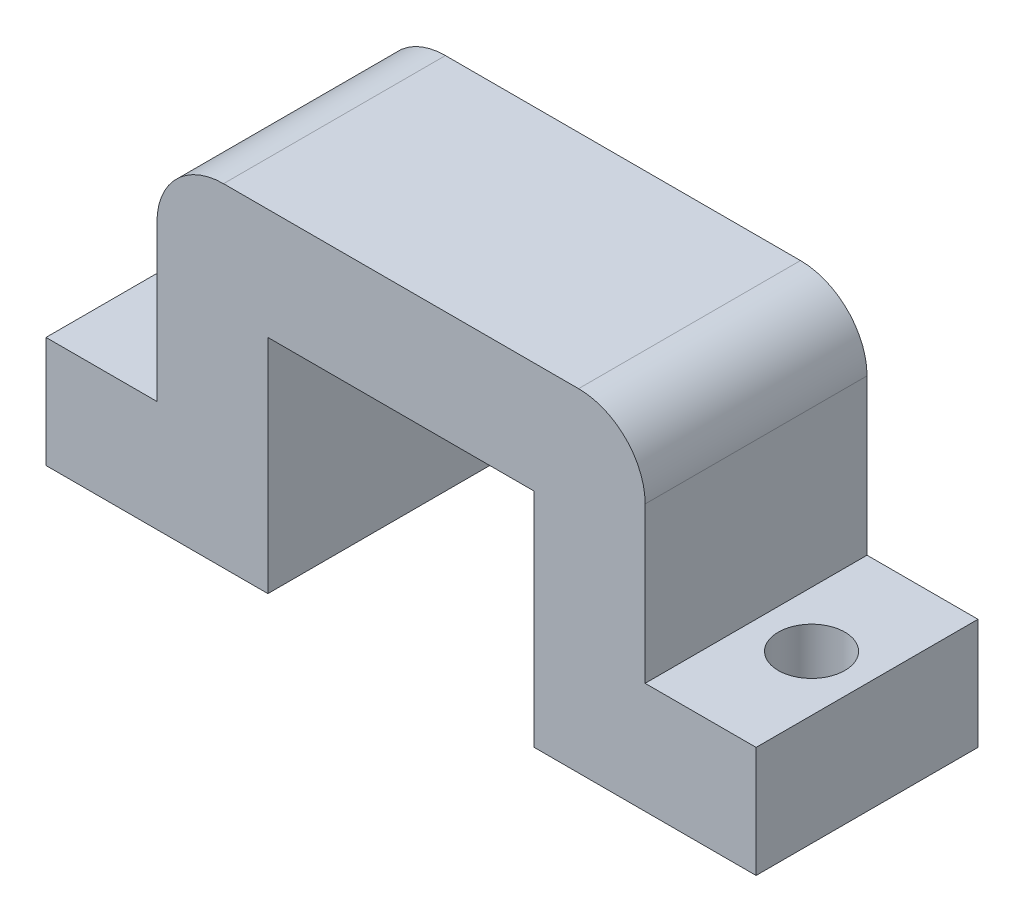
from build123d import *

# Parameters (mm, degrees)
BOSS_EXTRU_1_DEPTH      = 10
ESQUISSE2_R             = 1.5
ENL_V_MAT_EXTRU_1_DEPTH = 20


with BuildPart() as part:
    # Esquisse1 → Boss.-Extru.1 (new body)
    with BuildSketch(Plane.XY):
        with BuildLine():
            Line((0, 1.373626374), (0, 11.373626374))
            Line((0, 11.373626374), (12, 11.373626374))
            Line((12, 11.373626374), (12, 1.373626374))
            Line((12, 1.373626374), (22, 1.373626374))
            Line((22, 1.373626374), (22, 6.373626374))
            Line((22, 6.373626374), (17, 6.373626374))
            Line((17, 6.373626374), (17, 13.373626374))
            ThreePointArc((17, 13.373626374), (16.121320344, 15.494946717), (14, 16.373626374))
            Line((14, 16.373626374), (-2, 16.373626374))
            ThreePointArc((-2, 16.373626374), (-4.121320344, 15.494946717), (-5, 13.373626374))
            Line((-5, 13.373626374), (-5, 6.373626374))
            Line((-5, 6.373626374), (-10, 6.373626374))
            Line((-10, 6.373626374), (-10, 1.373626374))
            Line((-10, 1.373626374), (0, 1.373626374))
        make_face()
    extrude(amount=BOSS_EXTRU_1_DEPTH)

    # Esquisse2 → Enlèv. mat.-Extru.1 (cut)
    with BuildSketch(Plane(origin=(0, 6.373626374, 0), x_dir=(1, 0, 0), z_dir=(0, 1, 0))):
        with Locations((-7.5, -15)):
            Circle(ESQUISSE2_R)
        with Locations(Location((-7.5, -5, 0), (0, 0, 270))):
            Circle(ESQUISSE2_R)
        with Locations(Location((19.5, -5, 0), (0, 0, 270))):
            Circle(ESQUISSE2_R)
        with Locations((19.5, -15)):
            Circle(ESQUISSE2_R)
    extrude(amount=-ENL_V_MAT_EXTRU_1_DEPTH, mode=Mode.SUBTRACT)


solid = part.part
